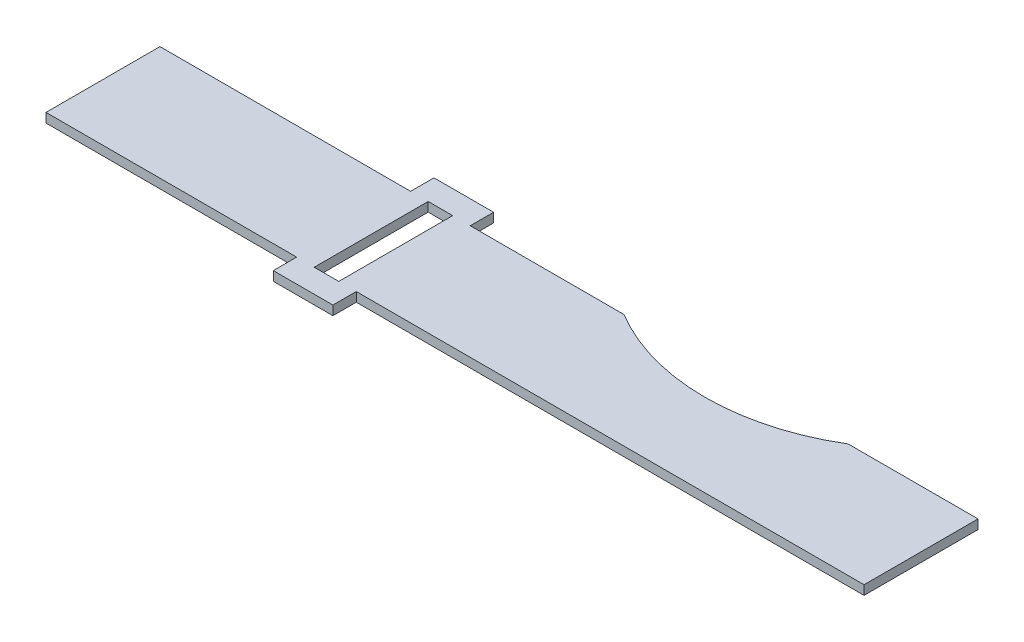
from build123d import *

# Parameters (mm, degrees)
SKETCH1_W           = 4.2
SKETCH1_H           = 19.5
BOSS_EXTRUDE1_DEPTH = 1.5875


with BuildPart() as part:
    # Sketch1 → Boss-Extrude1 (new body)
    with BuildSketch(Plane(origin=(0, 0, 0), x_dir=(1, 0, 0), z_dir=(0, 1, 0))):
        with BuildLine():
            Line((-16.9, -13.75), (-16.9, -9.75))
            Line((-16.9, -9.75), (70, -9.75))
            Line((70, -9.75), (70, 9.75))
            Line((70, 9.75), (47.791477279, 9.75))
            ThreePointArc((47.791477279, 9.75), (28.607181878, 4.414037573), (9.422886477, 9.75))
            Line((9.422886477, 9.75), (-16.9, 9.75))
            Line((-16.9, 9.75), (-16.9, 13.75))
            Line((-16.9, 13.75), (-27.1, 13.75))
            Line((-27.1, 13.75), (-27.1, 9.75))
            Line((-27.1, 9.75), (-70, 9.75))
            Line((-70, 9.75), (-70, -9.75))
            Line((-70, -9.75), (-27.1, -9.75))
            Line((-27.1, -9.75), (-27.1, -13.75))
            Line((-27.1, -13.75), (-16.9, -13.75))
        make_face()
        with Locations((-22, 0)):
            Rectangle(SKETCH1_W, SKETCH1_H, mode=Mode.SUBTRACT)
    extrude(amount=BOSS_EXTRUDE1_DEPTH)


solid = part.part
